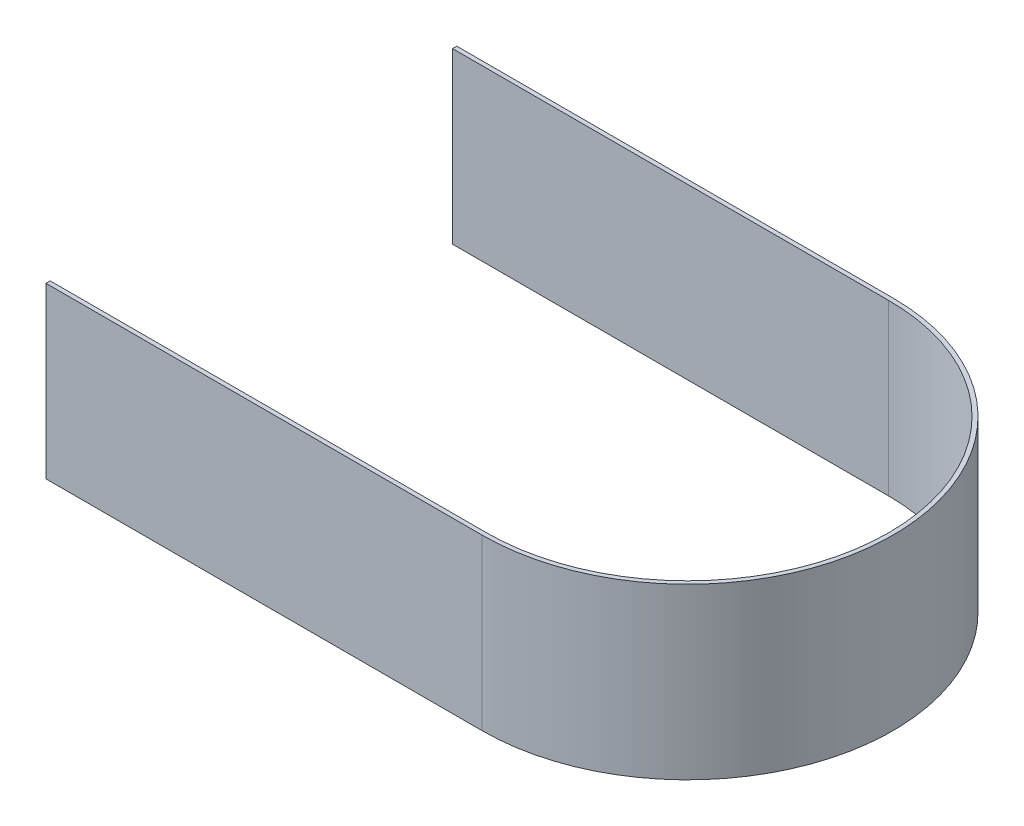
from build123d import *

# Parameters (mm, degrees)
BOSS_EXTRUDE1_DEPTH = 4


with BuildPart() as part:
    # Sketch1 → Boss-Extrude1 (new body)
    with BuildSketch(Plane(origin=(0, 0, 0), x_dir=(1, 0, 0), z_dir=(0, 1, 0))):
        with BuildLine():
            Line((0, 0), (10.3, 0))
            ThreePointArc((10.3, 0), (15.05, 4.75), (10.3, 9.5))
            Line((10.3, 9.5), (0, 9.5))
            Line((0, 9.5), (0, 9.6))
            Line((0, 9.6), (10.3, 9.6))
            ThreePointArc((10.3, 9.6), (15.15, 4.75), (10.3, -0.1))
            Line((10.3, -0.1), (0, -0.1))
            Line((0, -0.1), (0, 0))
        make_face()
    extrude(amount=BOSS_EXTRUDE1_DEPTH)


solid = part.part
